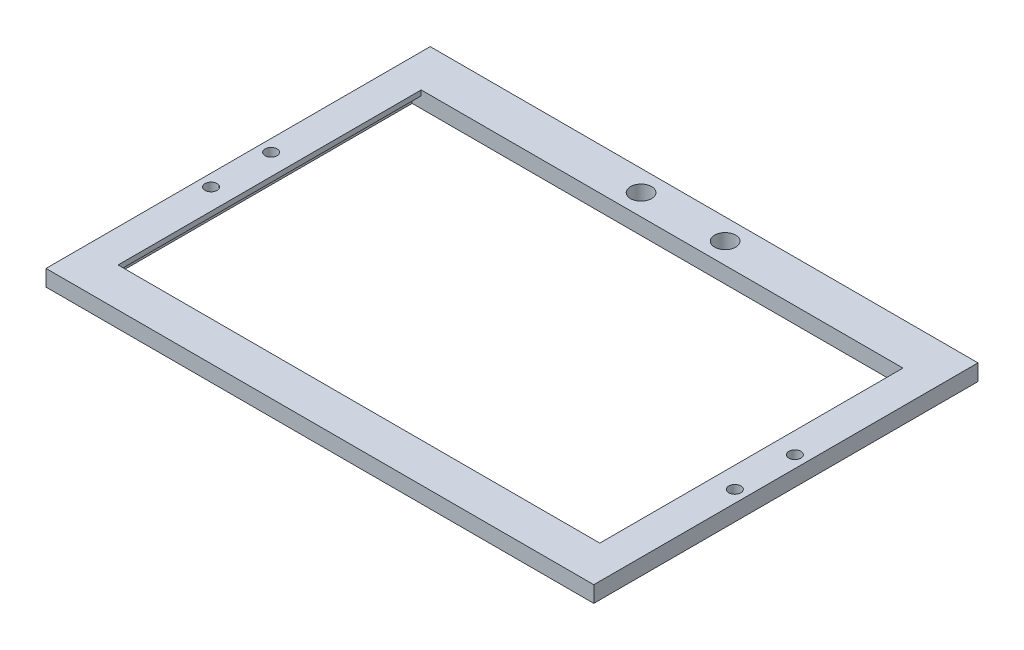
from build123d import *

# Parameters (mm, degrees)
SKETCH1_W               = 182.5
SKETCH1_H               = 128
SKETCH1_R               = 3.5
SKETCH1_R_2             = 2
BOSS_EXTRUDE1_DEPTH     = 5.4
CUT_EXTRUDE3_DEPTH      = 114.334560042
CUT_EXTRUDE3_DEPTH_BACK = 114.334560042
SKETCH1_4_W             = 160.5
SKETCH1_4_H             = 101
CUT_EXTRUDE4_DEPTH      = 3.7


with BuildPart() as part:
    # Sketch1 → Boss-Extrude1 (new body)
    with BuildSketch(Plane(origin=(0, 0, 0), x_dir=(1, 0, 0), z_dir=(0, 1, 0))):
        with Locations((0, 3)):
            Rectangle(SKETCH1_W, SKETCH1_H)
        with Locations((-14, 60)):
            Circle(SKETCH1_R, mode=Mode.SUBTRACT)
        with Locations((14, 60)):
            Circle(SKETCH1_R, mode=Mode.SUBTRACT)
        with Locations((-87.25, -10)):
            Circle(SKETCH1_R_2, mode=Mode.SUBTRACT)
        with Locations((87.25, -10)):
            Circle(SKETCH1_R_2, mode=Mode.SUBTRACT)
        with Locations((-87.25, 10)):
            Circle(SKETCH1_R_2, mode=Mode.SUBTRACT)
        with Locations((87.25, 10)):
            Circle(SKETCH1_R_2, mode=Mode.SUBTRACT)
    extrude(amount=BOSS_EXTRUDE1_DEPTH)

    # Sketch1<4> → Cut-Extrude3 (cut, two sides: drawn at the far end of the back side and taken through both)
    with BuildSketch(Plane(origin=(0, 0, 0), x_dir=(1, 0, 0), z_dir=(0, 1, 0)).offset(-CUT_EXTRUDE3_DEPTH_BACK)):
        with Locations((0, 2.5)):
            Rectangle(SKETCH1_4_W, SKETCH1_4_H)
    extrude(amount=CUT_EXTRUDE3_DEPTH + CUT_EXTRUDE3_DEPTH_BACK, mode=Mode.SUBTRACT)

    # Sketch1<5> → Cut-Extrude4 (cut)
    with BuildSketch(Plane(origin=(0, 0, 0), x_dir=(1, 0, 0), z_dir=(0, 1, 0))):
        Polygon((-83.25, -53), (83.25, -53), (83.25, 53), (80.25, 53), (80.25, -48), (-80.25, -48), (-80.25, 53), (-83.25, 53), align=None)
    extrude(amount=CUT_EXTRUDE4_DEPTH, mode=Mode.SUBTRACT)


solid = part.part
